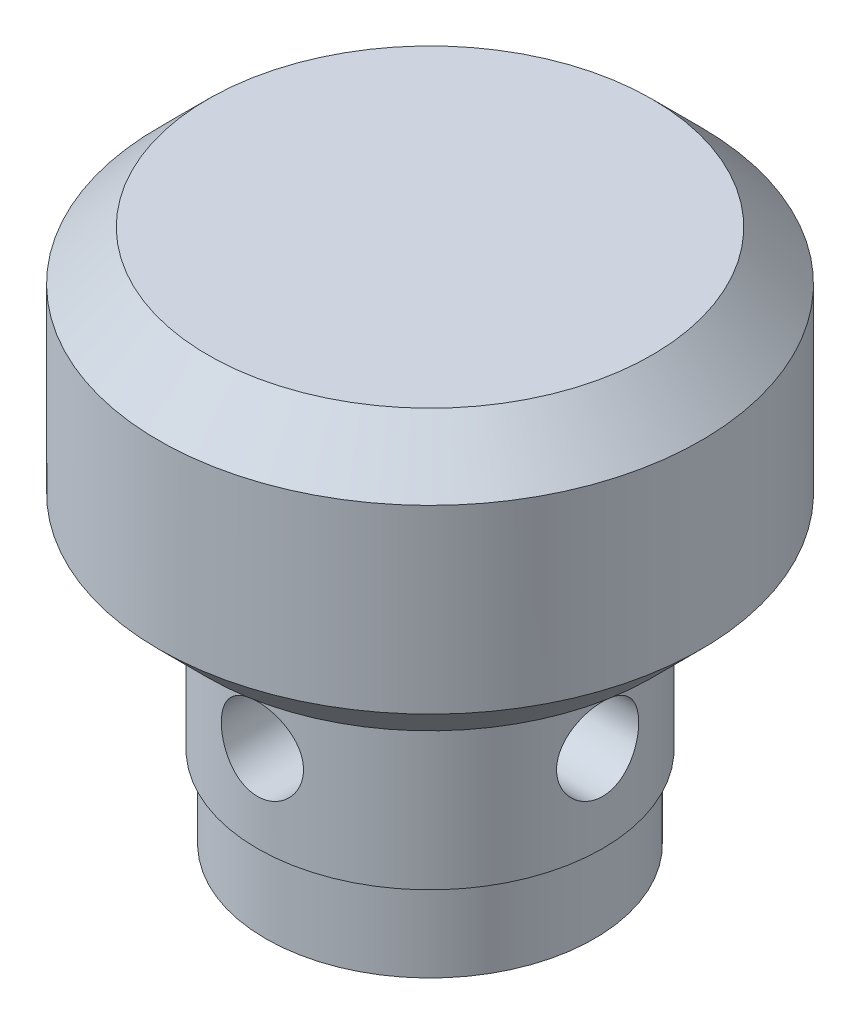
from build123d import *
from build123d.topology import SkipClean

# Parameters (mm, degrees)
SKETCH1_W           = 21
SKETCH1_H           = 21
BOSS_EXTRUDE1_DEPTH = 10.5
CUT_EXTRUDE1_DEPTH  = 24.5
CUT_EXTRUDE2_DEPTH  = 24.5
CUT_EXTRUDE3_DEPTH  = 24.5
SKETCH5_R           = 16.5
BOSS_EXTRUDE2_DEPTH = 17
CHAMFER4_SIZE       = 3
CHAMFER5_SIZE       = 3
SKETCH13_R          = 10
BOSS_EXTRUDE6_DEPTH = 5
SKETCH14_R          = 2.5
CUT_EXTRUDE7_DEPTH  = 10


with BuildPart() as part:
    # Sketch1 → Boss-Extrude1 (new body)
    with BuildSketch(Plane(origin=(0, 0, 0), x_dir=(1, 0, 0), z_dir=(0, 1, 0))):
        with Locations((1.107272727, 1.909090909)):
            Rectangle(SKETCH1_W, SKETCH1_H)
    extrude(amount=BOSS_EXTRUDE1_DEPTH)

    # Sketch2 → Cut-Extrude1 (cut)
    with BuildSketch(Plane.XY.offset(8.590909091)):
        with BuildLine():
            ThreePointArc((3.607272727, 5.25), (2.87503968, 7.017766953), (1.107272727, 7.75))
            Line((1.107272727, 7.75), (1.107272727, 2.75))
            ThreePointArc((1.107272727, 2.75), (2.87503968, 3.482233047), (3.607272727, 5.25))
        make_face()
        with BuildLine():
            Line((1.107272727, 2.75), (1.107272727, 7.75))
            ThreePointArc((1.107272727, 7.75), (-1.392727273, 5.25), (1.107272727, 2.75))
        make_face()
    extrude(amount=-CUT_EXTRUDE1_DEPTH, mode=Mode.SUBTRACT)

    # Sketch3 → Cut-Extrude2 (cut)
    with BuildSketch(Plane.ZY.offset(9.392727273)):
        with BuildLine():
            ThreePointArc((0.590909091, 5.25), (-0.141323956, 7.017766953), (-1.909090909, 7.75))
            Line((-1.909090909, 7.75), (-1.909090909, 2.75))
            ThreePointArc((-1.909090909, 2.75), (-0.141323956, 3.482233047), (0.590909091, 5.25))
        make_face()
        with BuildLine():
            Line((-1.909090909, 2.75), (-1.909090909, 7.75))
            ThreePointArc((-1.909090909, 7.75), (-4.409090909, 5.25), (-1.909090909, 2.75))
        make_face()
    extrude(amount=-CUT_EXTRUDE2_DEPTH, mode=Mode.SUBTRACT)

    # Sketch4 → Cut-Extrude3 (cut)
    with SkipClean():  # the faces are left unmerged after this step: merging them gives an invalid solid
        with BuildSketch(Plane(origin=(0, 10.5, 0), x_dir=(1, 0, 0), z_dir=(0, 1, 0))):
            with BuildLine():
                ThreePointArc((-9.392727273, 1.909090919), (-6.317348472, 9.333712115), (1.107272727, 12.409090909))
                Line((1.107272727, 12.409090909), (-9.392727273, 12.409090909))
                Line((-9.392727273, 12.409090909), (-9.392727273, 1.909090919))
            make_face()
            with BuildLine():
                Line((11.607272727, 12.409090909), (1.107272727, 12.409090909))
                ThreePointArc((1.107272727, 12.409090909), (8.53189393, 9.333712112), (11.607272727, 1.909090909))
                Line((11.607272727, 1.909090909), (11.607272727, 12.409090909))
            make_face()
            with BuildLine():
                ThreePointArc((11.607272727, 1.909090909), (8.53189393, -5.515530293), (1.107272727, -8.590909091))
                Line((1.107272727, -8.590909091), (11.607272727, -8.590909091))
                Line((11.607272727, -8.590909091), (11.607272727, 1.909090909))
            make_face()
            with BuildLine():
                Line((-9.392727273, -8.590909091), (1.107272727, -8.590909091))
                ThreePointArc((1.107272727, -8.590909091), (-6.317348479, -5.51553029), (-9.392727273, 1.909090919))
                Line((-9.392727273, 1.909090919), (-9.392727273, -8.590909091))
            make_face()
        extrude(amount=-CUT_EXTRUDE3_DEPTH, mode=Mode.SUBTRACT)

    # Sketch5 → Boss-Extrude2 (add)
    with SkipClean():  # the faces are left unmerged after this step: merging them gives an invalid solid
        with BuildSketch(Plane(origin=(0, 10.5, 0), x_dir=(1, 0, 0), z_dir=(0, 1, 0))):
            with Locations(Location((1.107272727, 1.909090909, 0), (0, 0, 270))):
                Circle(SKETCH5_R)
        extrude(amount=BOSS_EXTRUDE2_DEPTH)

    # Chamfer4
    chamfer4_edges = [part.edges().sort_by_distance(p)[0] for p in [
        (1.107272727, 27.5, -18.409090909),
    ]]
    chamfer(chamfer4_edges, length=CHAMFER4_SIZE)

    # Chamfer5
    chamfer5_edges = [part.edges().sort_by_distance(p)[0] for p in [
        (1.107272727, 10.5, -18.409090909),
    ]]
    chamfer(chamfer5_edges, length=CHAMFER5_SIZE)

    # Sketch13 → Boss-Extrude6 (add)
    with SkipClean():  # the faces are left unmerged after this step: merging them gives an invalid solid
        with BuildSketch(Plane.XZ):
            with Locations(Location((1.107272727, -1.909090909, 0), (0, 0, 270))):
                Circle(SKETCH13_R)
        extrude(amount=BOSS_EXTRUDE6_DEPTH)

    # Sketch14 → Cut-Extrude7 (cut)
    with SkipClean():  # the faces are left unmerged after this step: merging them gives an invalid solid
        with BuildSketch(Plane.XZ.offset(5)):
            with Locations(Location((1.107272727, -1.909090909, 0), (0, 0, 270))):
                Circle(SKETCH14_R)
        extrude(amount=-CUT_EXTRUDE7_DEPTH, mode=Mode.SUBTRACT)


solid = part.part
